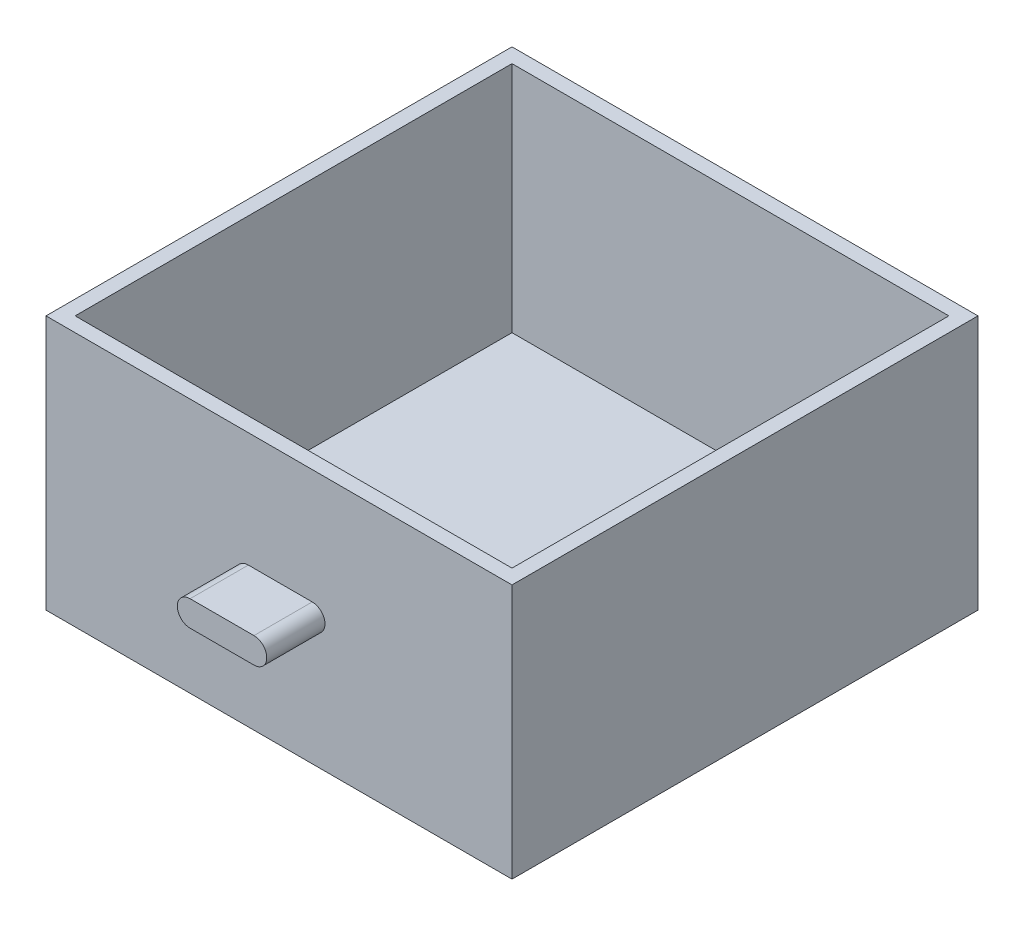
from build123d import *

# Parameters (mm, degrees)
SKETCH_1_W      = 60
SKETCH_1_H      = 60
EXTRUDE_1_DEPTH = 3
SKETCH_2_W      = 60
SKETCH_2_H      = 60
EXTRUDE_2_DEPTH = 35
EXTRUDE_3_DEPTH = 8


with BuildPart() as part:
    # 草图1 → 凸台-拉伸1 (new body)
    with BuildSketch(Plane(origin=(0, 0, 0), x_dir=(1, 0, 0), z_dir=(0, 1, 0))):
        Rectangle(SKETCH_1_W, SKETCH_1_H)
    extrude(amount=EXTRUDE_1_DEPTH)

    # 草图2 → 凸台-拉伸2 (add)
    with BuildSketch(Plane(origin=(0, 0, 0), x_dir=(1, 0, 0), z_dir=(0, 1, 0))):
        Polygon((-30, 32), (32, 32), (32, -32), (-32, -32), (-32, 32), align=None)
        Rectangle(SKETCH_2_W, SKETCH_2_H, mode=Mode.SUBTRACT)
    extrude(amount=EXTRUDE_2_DEPTH)

    # 草图3 → 凸台-拉伸3 (add)
    with BuildSketch(Plane.XY.offset(32)):
        with BuildLine():
            Line((-4.210680383, 19.255087703), (4.561970296, 19.255087703))
            ThreePointArc((4.561970296, 19.255087703), (6.317057998, 17.5), (4.561970296, 15.744912297))
            Line((4.561970296, 15.744912297), (-4.210680383, 15.744912297))
            ThreePointArc((-4.210680383, 15.744912297), (-5.965768086, 17.5), (-4.210680383, 19.255087703))
        make_face()
    extrude(amount=EXTRUDE_3_DEPTH)


solid = part.part
